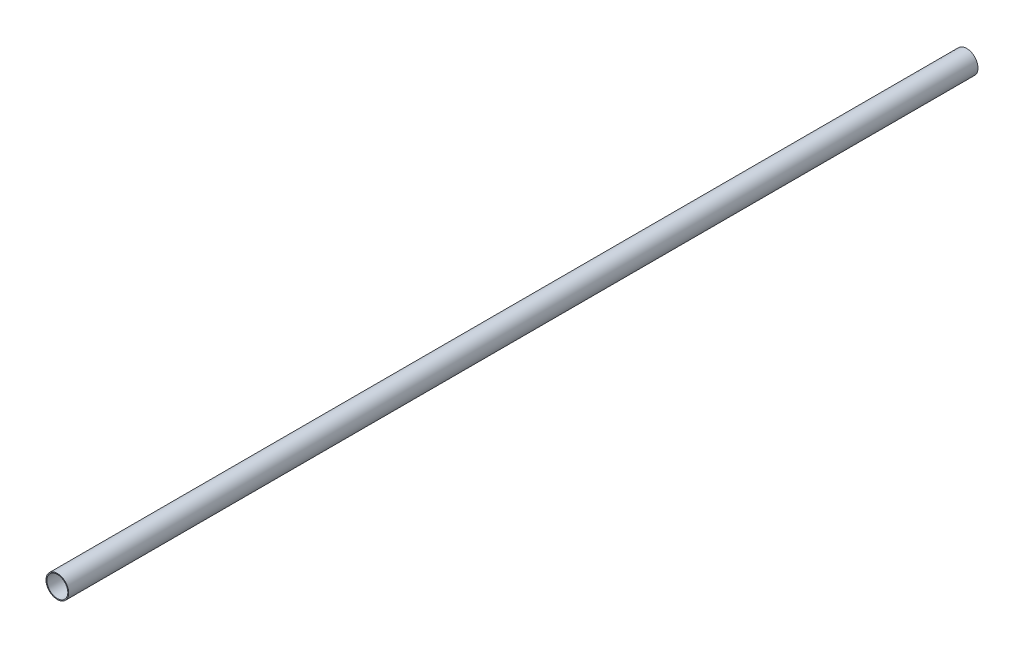
from build123d import *

# Parameters (mm, degrees)
SKETCH1_R           = 12.5
SKETCH1_R_2         = 11.5
BOSS_EXTRUDE2_DEPTH = 1000


with BuildPart() as part:
    # Sketch1 → Boss-Extrude2 (new body)
    with BuildSketch(Plane.XY):
        Circle(SKETCH1_R)
        Circle(SKETCH1_R_2, mode=Mode.SUBTRACT)
    extrude(amount=BOSS_EXTRUDE2_DEPTH)


solid = part.part
